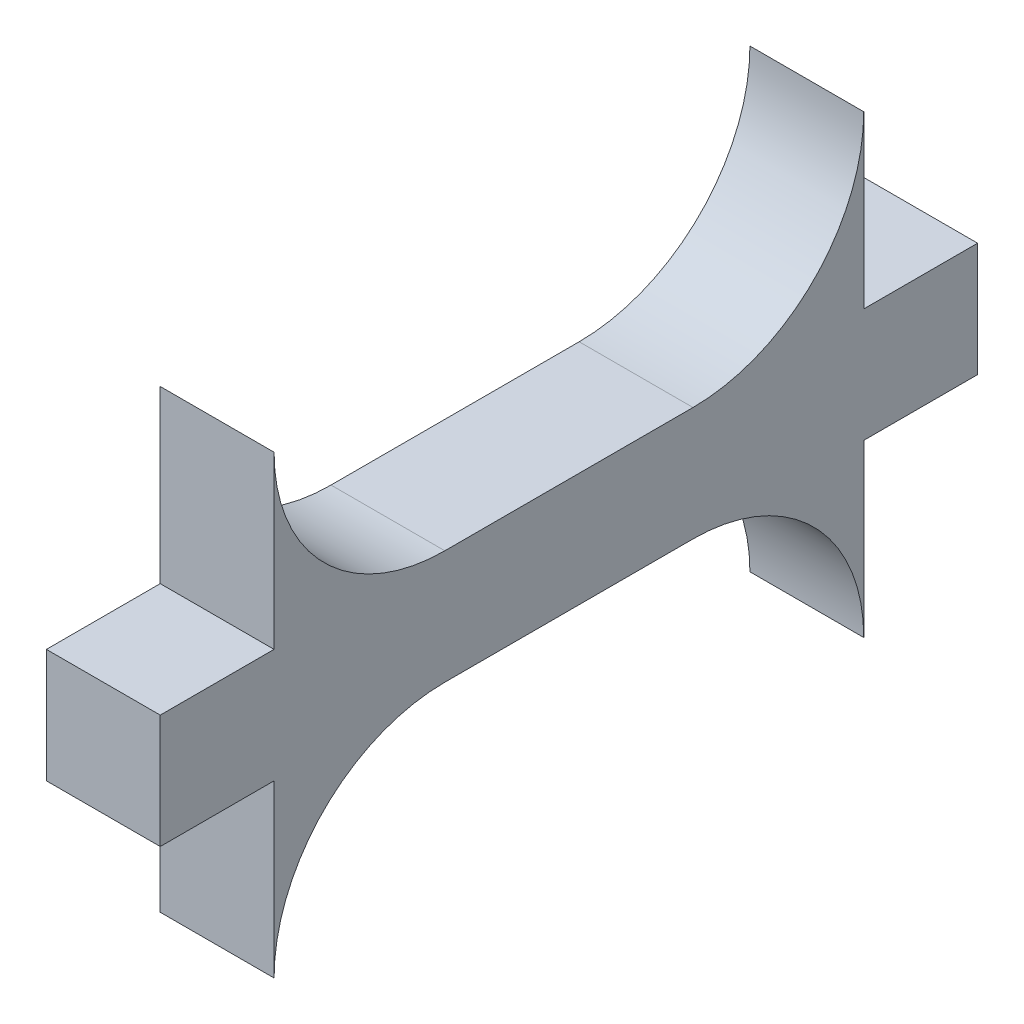
from build123d import *

# Parameters (mm, degrees)
BOSS_EXTRUDE1_DEPTH = 10
SKETCH2_W           = 10
SKETCH2_H           = 10
BOSS_EXTRUDE2_DEPTH = 10


with BuildPart() as part:
    # Sketch1 → Boss-Extrude1 (new body)
    with BuildSketch(Plane(origin=(0, 0, 0), x_dir=(0, 0, -1), z_dir=(1, 0, 0))):
        with BuildLine():
            Line((-8.804034582, 5), (12.995965418, 5))
            ThreePointArc((12.995965418, 5), (23.602567136, 9.393398282), (27.995965418, 20))
            Line((27.995965418, 20), (27.995965418, -20))
            ThreePointArc((27.995965418, -20), (23.602567136, -9.393398282), (12.995965418, -5))
            Line((12.995965418, -5), (-8.804034582, -5))
            ThreePointArc((-8.804034582, -5), (-19.4106363, -9.393398282), (-23.804034582, -20))
            Line((-23.804034582, -20), (-23.804034582, 20))
            ThreePointArc((-23.804034582, 20), (-19.4106363, 9.393398282), (-8.804034582, 5))
        make_face()
    extrude(amount=BOSS_EXTRUDE1_DEPTH)

    # Sketch2 → Boss-Extrude2 (add)
    with BuildSketch(Plane.XY.offset(23.804034582)):
        with Locations((5, 0)):
            Rectangle(SKETCH2_W, SKETCH2_H)
    boss_extrude2 = extrude(amount=BOSS_EXTRUDE2_DEPTH)

    # Mirror1: Boss-Extrude2 across plane
    add(boss_extrude2.mirror(Plane(origin=(0, 0, -2.095965418), x_dir=(1, 0, 0), z_dir=(0, 0, -1))))


solid = part.part
